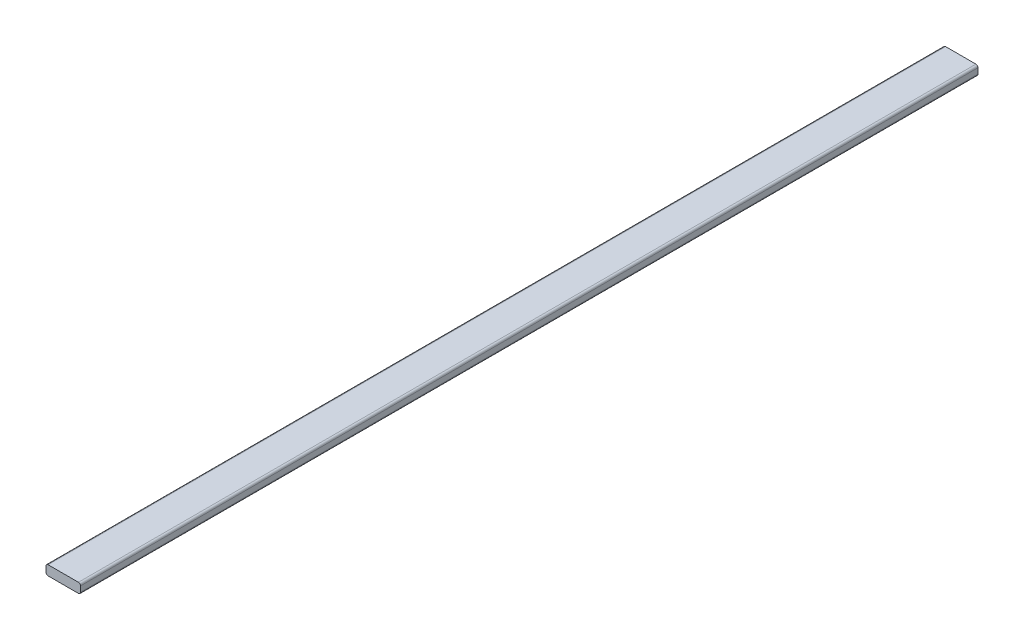
from build123d import *

# Parameters (mm, degrees)
SKETCH2_W           = 12.7
SKETCH2_H           = 3.556
BOSS_EXTRUDE1_DEPTH = 330.2
FILLET1_R           = 0.762


with BuildPart() as part:
    # Sketch2 → Boss-Extrude1 (new body)
    with BuildSketch(Plane.XY):
        with Locations((6.35, 1.778)):
            Rectangle(SKETCH2_W, SKETCH2_H)
    extrude(amount=BOSS_EXTRUDE1_DEPTH)

    # Fillet1
    fillet1_edges = [part.edges().sort_by_distance(p)[0] for p in [
        (0, 3.556, 165.1),
        (12.7, 3.556, 165.1),
        (12.7, 0, 165.1),
        (0, 0, 165.1),
    ]]
    fillet(fillet1_edges, radius=FILLET1_R)


solid = part.part
